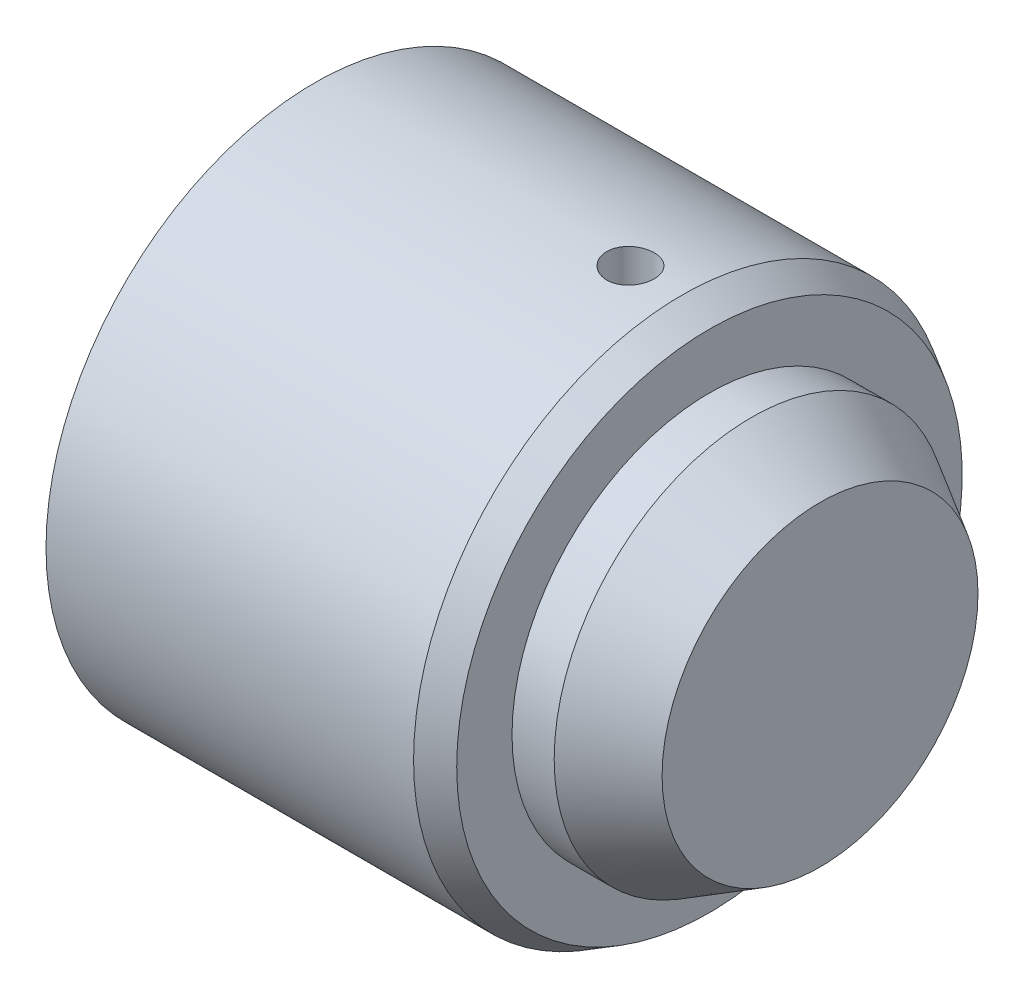
from build123d import *

# Parameters (mm, degrees)
CHAMFER_1_SIZE               = 2.5
CHAMFER_1_SIZE2              = 4.330127019
CHAMFER_2_SIZE               = 1
CHAMFER_2_SIZE2              = 1.732050808
HOLE_WIZARD_M6_1_D           = 5
HOLE_WIZARD_M6_1_DEPTH       = 8
HOLE_WIZARD_M6_1_CSINK_D     = 8
HOLE_WIZARD_M6_1_CSINK_ANGLE = 90
HOLE_WIZARD_M6_1_TIP         = 1.502151548
SKETCH_4_R                   = 1.5
CUT_EXTRUDE_1_DEPTH          = 20


with BuildPart() as part:
    # 草图1 (on Front Plane) → 旋转1 (revolve)
    with BuildSketch(Plane.XY, mode=Mode.PRIVATE) as revolve_1_sk:
        Polygon((0, 0), (0, 12.5), (-7, 12.5), (-7, 17), (-32, 17), (-32, 14), (-10, 14), (-10, 0), align=None)
    revolve(revolve_1_sk.sketch.rotate(Axis((-10, 0, 0), (1, 0, 0)), 90), axis=Axis((-10, 0, 0), (1, 0, 0)))

    # 倒角1
    chamfer_1_edges = [part.edges().sort_by_distance(p)[0] for p in [
        (0, 0, -12.5),
    ]]
    chamfer_1_side = [part.faces().sort_by_distance(p)[0] for p in [
        (0, 0, 0),
    ]]
    chamfer(chamfer_1_edges, length=CHAMFER_1_SIZE, length2=CHAMFER_1_SIZE2, reference=chamfer_1_side[0])

    # 倒角2
    chamfer_2_edges = [part.edges().sort_by_distance(p)[0] for p in [
        (-7, 0, -17),
    ]]
    chamfer_2_side = [part.faces().sort_by_distance(p)[0] for p in [
        (-7, 0, -12.980832611),
    ]]
    chamfer(chamfer_2_edges, length=CHAMFER_2_SIZE, length2=CHAMFER_2_SIZE2, reference=chamfer_2_side[0])

    # M6 螺纹孔1
    with Locations(Plane(origin=(-10, 0, 0), x_dir=(0, 0, -1), z_dir=(-1, 0, 0))):
        with Locations((0, 0)):
            CounterSinkHole(HOLE_WIZARD_M6_1_D / 2, HOLE_WIZARD_M6_1_CSINK_D / 2, depth=HOLE_WIZARD_M6_1_DEPTH, counter_sink_angle=HOLE_WIZARD_M6_1_CSINK_ANGLE)
            with Locations((0, 0, -(HOLE_WIZARD_M6_1_DEPTH + HOLE_WIZARD_M6_1_TIP / 2))):  # 118° drill point
                Cone(0, HOLE_WIZARD_M6_1_D / 2, HOLE_WIZARD_M6_1_TIP, mode=Mode.SUBTRACT)

    # 草图4 → 切除-拉伸1 (cut, symmetric)
    with BuildSketch(Plane(origin=(0, 0, 0), x_dir=(1, 0, 0), z_dir=(0, 1, 0))):
        with Locations(Location((-12, 0, 0), (0, 0, 270))):
            Circle(SKETCH_4_R)
    extrude(amount=CUT_EXTRUDE_1_DEPTH, both=True, mode=Mode.SUBTRACT)


solid = part.part
